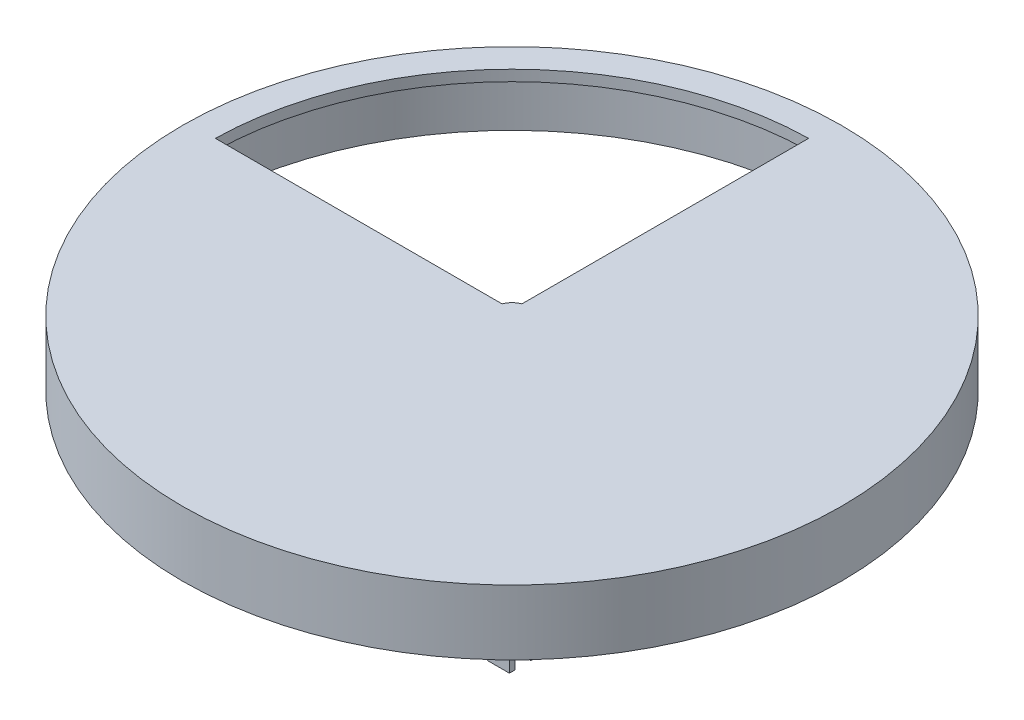
from build123d import *

# Parameters (mm, degrees)
ESQUISSE1_R             = 61
BOSS_EXTRU_1_DEPTH      = 2
BOSS_EXTRU_2_START      = 10
ESQUISSE2_R             = 61
ESQUISSE2_R_2           = 59
BOSS_EXTRU_2_DEPTH      = 10
ESQUISSE3_R             = 3
BOSS_EXTRU_3_DEPTH      = 10
ENL_V_MAT_EXTRU_6_DEPTH = 10
ESQUISSE7_W             = 4.037056784
ESQUISSE7_H             = 1
BOSS_EXTRU_4_DEPTH      = 53


with BuildPart() as part:
    # Esquisse1 → Boss.-Extru.1 (new body)
    with BuildSketch(Plane(origin=(0, 0, 0), x_dir=(1, 0, 0), z_dir=(0, 1, 0))):
        with Locations(Location((0, 0, 0), (0, 0, 270))):
            Circle(ESQUISSE1_R)
    extrude(amount=BOSS_EXTRU_1_DEPTH)

    # Esquisse2 → Boss.-Extru.2 (add)
    with BuildSketch(Plane(origin=(0, 0, 0), x_dir=(-1, 0, 0), z_dir=(0, -1, 0)).offset(BOSS_EXTRU_2_START)):
        with Locations(Location((0, 0, 0), (0, 0, 90))):
            Circle(ESQUISSE2_R)
        with Locations(Location((0, 0, 0), (0, 0, 90))):
            Circle(ESQUISSE2_R_2, mode=Mode.SUBTRACT)
    extrude(amount=-BOSS_EXTRU_2_DEPTH)

    # Esquisse3 → Boss.-Extru.3 (add)
    with BuildSketch(Plane(origin=(0, 0, 0), x_dir=(-1, 0, 0), z_dir=(0, -1, 0))):
        with Locations(Location((0, 0, 0), (0, 0, 270))):
            Circle(ESQUISSE3_R)
    extrude(amount=BOSS_EXTRU_3_DEPTH)

    # Esquisse5 → Enlèv. mat.-Extru.6 (cut)
    with BuildSketch(Plane(origin=(0, 2, 0), x_dir=(1, 0, 0), z_dir=(0, 1, 0))):
        with BuildLine():
            ThreePointArc((-55.883459525, 1), (-39.521899299, 39.521899299), (-1, 55.883459525))
            Line((-1, 55.883459525), (-1, 2.828427125))
            ThreePointArc((-1, 2.828427125), (-2.121320344, 2.121320344), (-2.828427125, 1))
            Line((-2.828427125, 1), (-55.883459525, 1))
        make_face()
    extrude(amount=-ENL_V_MAT_EXTRU_6_DEPTH, mode=Mode.SUBTRACT)

    # Esquisse7 → Boss.-Extru.4 (add)
    with BuildSketch(Plane(origin=(0, 0, 0), x_dir=(-1, 0, 0), z_dir=(0, -1, 0))):
        with Locations((0.001904175, -2)):
            Rectangle(ESQUISSE7_W, ESQUISSE7_H)
        with BuildLine():
            Line((-2.007102857, 1.502061623), (-2.007102857, 2.5))
            Line((-2.007102857, 2.5), (1.607669388, 2.5))
            ThreePointArc((1.607669388, 2.5), (1.792908074, 2.346421898), (1.992897143, 2.212616159))
            Line((1.992897143, 2.212616159), (1.992897143, 1.502061623))
            Line((1.992897143, 1.502061623), (-2.007102857, 1.502061623))
        make_face()
    extrude(amount=BOSS_EXTRU_4_DEPTH)


solid = part.part
